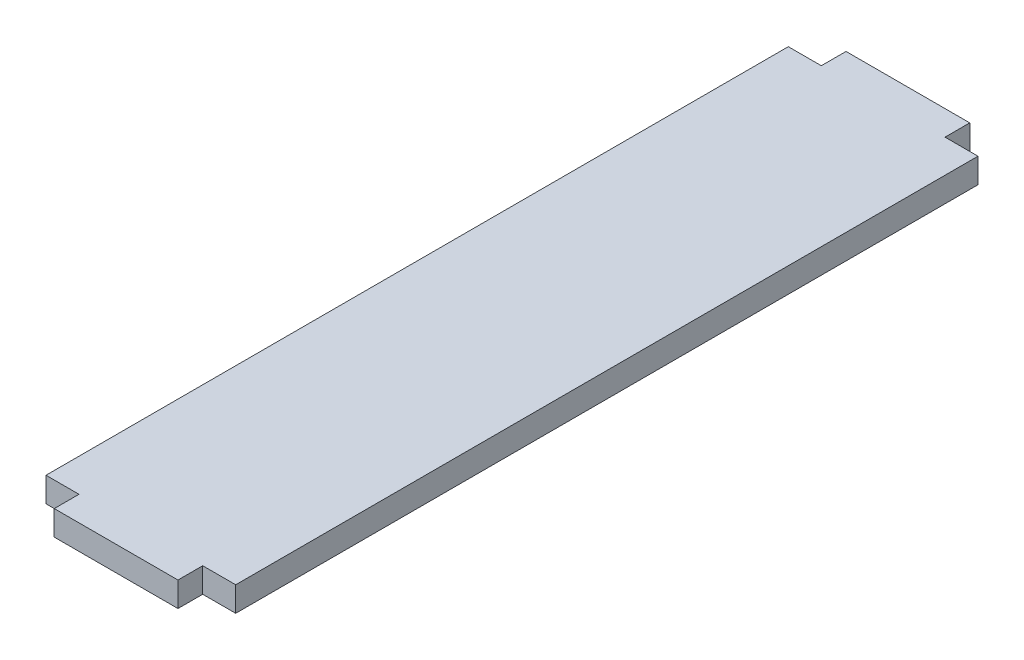
from build123d import *

# Parameters (mm, degrees)
BOSS_EXTRUDE1_DEPTH = 1.5


with BuildPart() as part:
    # Sketch1 → Boss-Extrude1 (new body)
    with BuildSketch(Plane(origin=(0, 0, 0), x_dir=(1, 0, 0), z_dir=(0, 1, 0))):
        Polygon((3.75, 22.5), (5.75, 22.5), (5.75, -22.5), (3.75, -22.5), (3.75, -24), (-3.75, -24), (-3.75, -22.5), (-5.75, -22.5), (-5.75, 22.5), (-3.75, 22.5), (-3.75, 24), (3.75, 24), align=None)
    extrude(amount=BOSS_EXTRUDE1_DEPTH)


solid = part.part
